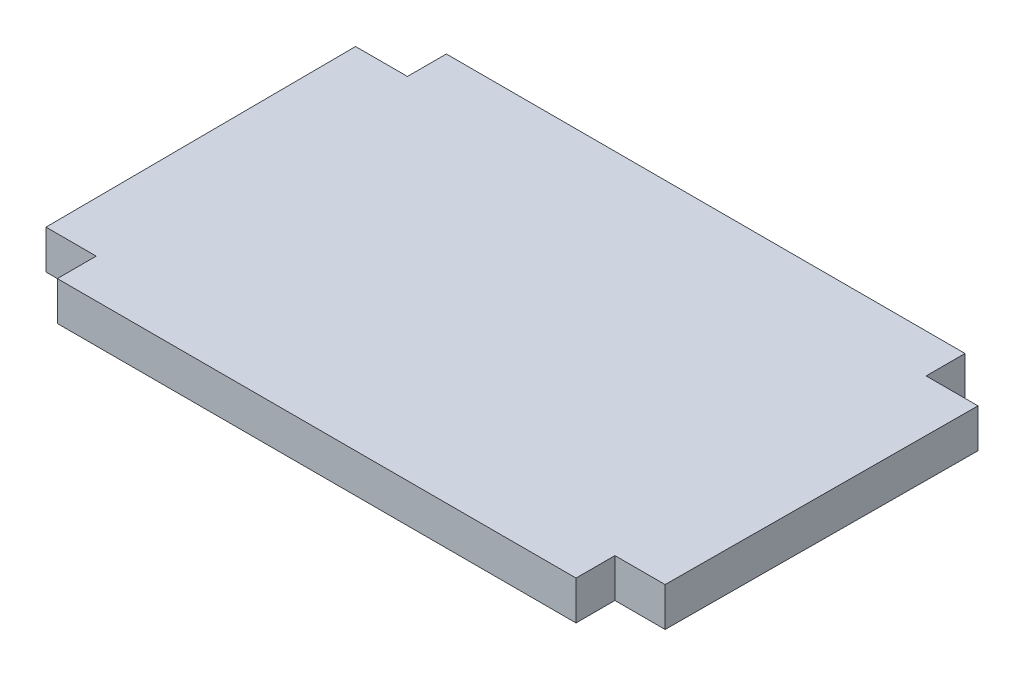
from build123d import *

# Parameters (mm, degrees)
SALIENTE_EXTRUIR1_DEPTH = 3


with BuildPart() as part:
    # Croquis2 → Saliente-Extruir1 (new body)
    with BuildSketch(Plane(origin=(0, 0, 0), x_dir=(1, 0, 0), z_dir=(0, 1, 0))):
        Polygon((40, -14.999663429), (40, -11.999663429), (43.872896428, -11.999663429), (44, 12), (40, 12), (40, 15), (0, 15), (0, 12), (-4, 12), (-3.872896428, -11.999663429), (0, -11.999663429), (0, -14.999663429), align=None)
    extrude(amount=SALIENTE_EXTRUIR1_DEPTH)


solid = part.part
